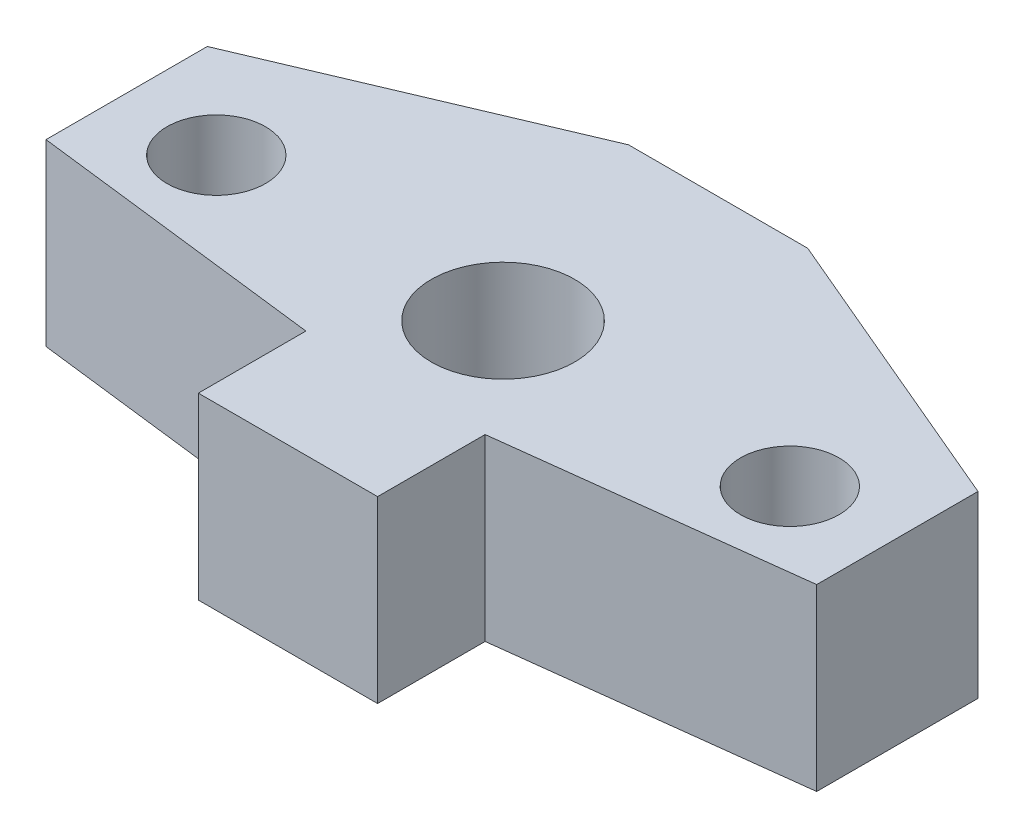
from build123d import *

# Parameters (mm, degrees)
SKETCH_1_R      = 2.75
SKETCH_1_R_2    = 4
EXTRUDE_1_DEPTH = 10


with BuildPart() as part:
    # Эскиз1 → Бобышка-Вытянуть1 (new body)
    with BuildSketch(Plane(origin=(0, 0, 0), x_dir=(1, 0, 0), z_dir=(0, 1, 0))):
        Polygon((16.5, 0), (26.5, 0), (26.5, 6), (43, 8), (43, 17), (26.5, 24), (16.5, 24), (0, 17), (0, 8), (16.5, 6), align=None)
        with Locations(Location((5.5, 12, 0), (0, 0, 270))):
            Circle(SKETCH_1_R, mode=Mode.SUBTRACT)
        with Locations(Location((37.5, 12, 0), (0, 0, 270))):
            Circle(SKETCH_1_R, mode=Mode.SUBTRACT)
        with Locations(Location((21.5, 12, 0), (0, 0, 270))):
            Circle(SKETCH_1_R_2, mode=Mode.SUBTRACT)
    extrude(amount=EXTRUDE_1_DEPTH)


solid = part.part
